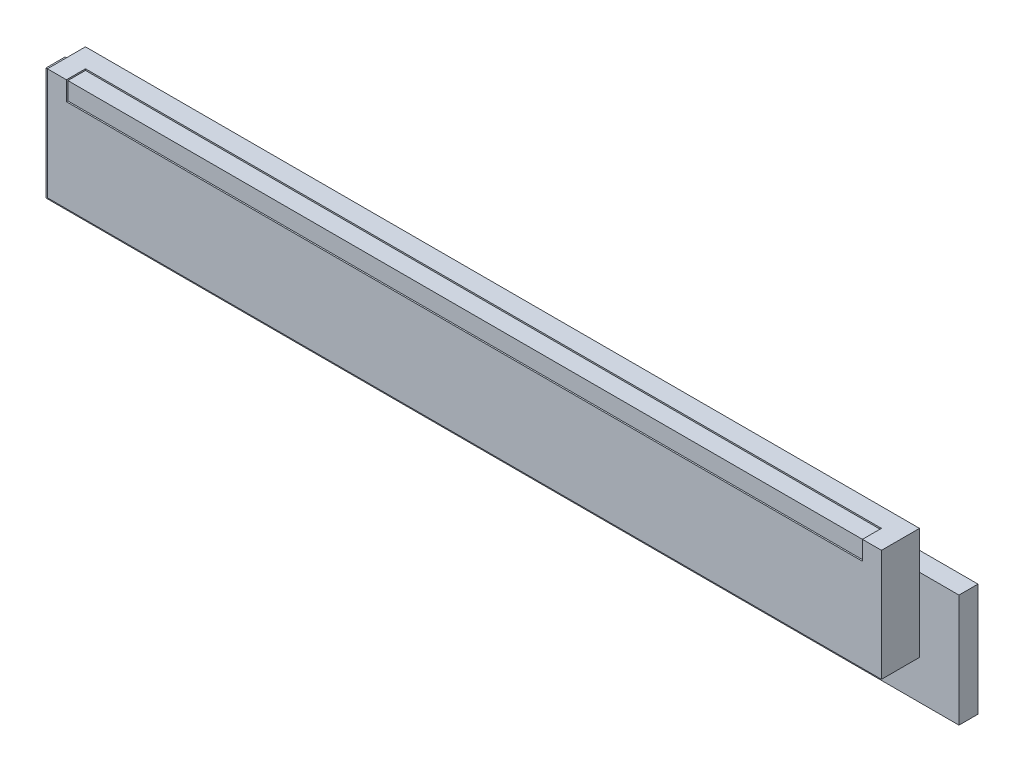
from build123d import *

# Parameters (mm, degrees)
SKETCH1_W           = 1920
SKETCH1_H           = 237
BOSS_EXTRUDE1_DEPTH = 40
SKETCH2_W           = 1920
SKETCH2_H           = 317
BOSS_EXTRUDE2_DEPTH = 80
SKETCH3_W           = 23
SKETCH3_H           = 80
CUT_EXTRUDE2_DEPTH  = 1019.081038032
SKETCH6_W           = 80
SKETCH6_H           = 82
CUT_EXTRUDE3_DEPTH  = 1912.128266234
SKETCH7_W           = 60
SKETCH7_H           = 80
CUT_EXTRUDE4_DEPTH  = 1019.081038032
CUT_EXTRUDE5_DEPTH  = 1674


with BuildPart() as part:
    # Sketch1 → Boss-Extrude1 (new body)
    with BuildSketch(Plane.XY):
        Rectangle(SKETCH1_W, SKETCH1_H)
    extrude(amount=BOSS_EXTRUDE1_DEPTH)

    # Sketch2 → Boss-Extrude2 (add)
    with BuildSketch(Plane.XY.offset(40)):
        with Locations((0, 40)):
            Rectangle(SKETCH2_W, SKETCH2_H)
    extrude(amount=BOSS_EXTRUDE2_DEPTH)

    # Sketch3 → Cut-Extrude2 (cut, through all)
    with BuildSketch(Plane(origin=(0, 198.5, 0), x_dir=(1, 0, 0), z_dir=(0, 1, 0))):
        with Locations((-948.5, -80)):
            Rectangle(SKETCH3_W, SKETCH3_H)
        with Locations((948.5, -80)):
            Rectangle(SKETCH3_W, SKETCH3_H)
    extrude(amount=-CUT_EXTRUDE2_DEPTH, mode=Mode.SUBTRACT)

    # Sketch6 → Cut-Extrude3 (cut, through all)
    with BuildSketch(Plane(origin=(937, 0, 0), x_dir=(0, 0, -1), z_dir=(1, 0, 0))):
        with Locations((-80, -77.5)):
            Rectangle(SKETCH6_W, SKETCH6_H)
    extrude(amount=-CUT_EXTRUDE3_DEPTH, mode=Mode.SUBTRACT)

    # Sketch7 → Cut-Extrude4 (cut, through all)
    with BuildSketch(Plane(origin=(0, 198.5, 0), x_dir=(1, 0, 0), z_dir=(0, 1, 0))):
        with Locations((-907, -80)):
            Rectangle(SKETCH7_W, SKETCH7_H)
        with Locations((907, -80)):
            Rectangle(SKETCH7_W, SKETCH7_H)
    extrude(amount=-CUT_EXTRUDE4_DEPTH, mode=Mode.SUBTRACT)

    # Sketch8 → Cut-Extrude5 (cut)
    with BuildSketch(Plane(origin=(837, 0, 0), x_dir=(0, 0, -1), z_dir=(1, 0, 0))):
        Polygon((-117, 158.5), (-117, 195.5), (-80, 195.5), (-80, 198.5), (-120, 198.5), (-120, 158.5), align=None)
    extrude(amount=-CUT_EXTRUDE5_DEPTH, mode=Mode.SUBTRACT)


solid = part.part
